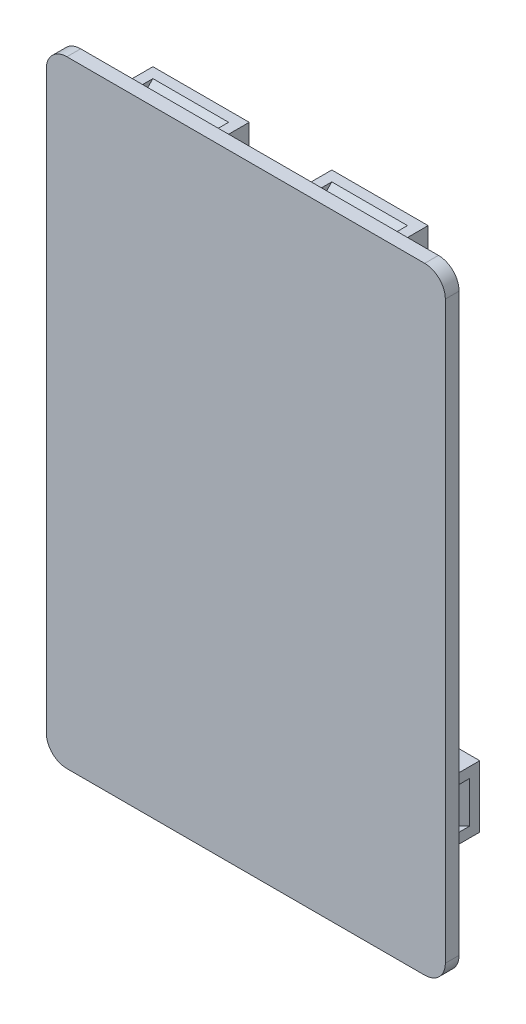
from build123d import *

# Parameters (mm, degrees)
EXTRUDE_1_DEPTH     = 2
SKETCH_4_W          = 11
SKETCH_4_H          = 1.5
EXTRUDE_3_DEPTH     = 4.5
CUT_EXTRUDE_3_DEPTH = 60
SKETCH_6_W          = 1.5
SKETCH_6_H          = 1.5
EXTRUDE_4_DEPTH     = 1.5
SKETCH_8_W          = 1.5
SKETCH_8_H          = 6
EXTRUDE_5_DEPTH     = 4.5
CUT_EXTRUDE_4_DEPTH = 20
SKETCH_12_W         = 1.5
SKETCH_12_H         = 1.5
EXTRUDE_7_DEPTH     = 1.5
SKETCH_13_W         = 1.5
SKETCH_13_H         = 1.5
EXTRUDE_8_DEPTH     = 1.5


with BuildPart() as part:
    # 草图2 → 凸台-拉伸1 (new body)
    with BuildSketch(Plane.XY):
        with BuildLine():
            Line((0, 86.6), (0, 3))
            ThreePointArc((0, 3), (0.878679656, 0.878679656), (3, 0))
            Line((3, 0), (55, 0))
            ThreePointArc((55, 0), (57.121320344, 0.878679656), (58, 3))
            Line((58, 3), (58, 86.6))
            ThreePointArc((58, 86.6), (57.121320344, 88.721320344), (55, 89.6))
            Line((55, 89.6), (3, 89.6))
            ThreePointArc((3, 89.6), (0.878679656, 88.721320344), (0, 86.6))
        make_face()
    extrude(amount=EXTRUDE_1_DEPTH)

    # 草图4 → 凸台-拉伸3 (add)
    with BuildSketch(Plane(origin=(0, 0, 0), x_dir=(-1, 0, 0), z_dir=(0, 0, -1))):
        Polygon((-35, 85.1), (-35, 88.1), (-36.5, 88.1), (-36.5, 86.6), (-47.5, 86.6), (-47.5, 88.1), (-49, 88.1), (-49, 85.1), align=None)
        Polygon((-21.5, 88.1), (-10.5, 88.1), (-9, 88.1), (-9, 85.1), (-23, 85.1), (-23, 88.1), align=None)
        with Locations((-42, 87.35)):
            Rectangle(SKETCH_4_W, SKETCH_4_H)
    extrude(amount=EXTRUDE_3_DEPTH)

    # 草图5 → 切除-拉伸3 (cut)
    with BuildSketch(Plane(origin=(49, 0, 0), x_dir=(0, 0, -1), z_dir=(1, 0, 0))):
        Polygon((1.5, 88.1), (1.5, 86.6), (3, 88.1), align=None)
        Polygon((0, 88.1), (1.5, 86.6), (1.5, 88.1), align=None)
    extrude(amount=-CUT_EXTRUDE_3_DEPTH, mode=Mode.SUBTRACT)

    # 草图6 → 凸台-拉伸4 (add)
    with BuildSketch(Plane(origin=(0, 88.1, 0), x_dir=(1, 0, 0), z_dir=(0, 1, 0))):
        Polygon((9, 0), (10.5, 0), (10.5, 4.5), (9, 4.5), (9, 3), (9, 1.5), align=None)
        Polygon((21.5, 0), (23, 0), (23, 1.5), (23, 3), (23, 4.5), (21.5, 4.5), align=None)
        with Locations((35.75, 3.75)):
            Rectangle(SKETCH_6_W, SKETCH_6_H)
        Polygon((36.5, 3), (35, 3), (35, 1.5), (35, 0), (36.5, 0), align=None)
        Polygon((49, 3), (47.5, 3), (47.5, 0), (49, 0), (49, 1.5), align=None)
        with Locations((48.25, 3.75)):
            Rectangle(SKETCH_6_W, SKETCH_6_H)
    extrude(amount=-EXTRUDE_4_DEPTH)

    # 草图8 → 凸台-拉伸5 (add)
    with BuildSketch(Plane(origin=(0, 0, 0), x_dir=(-1, 0, 0), z_dir=(0, 0, -1))):
        Polygon((-53.5, 24.5), (-56.5, 24.5), (-56.5, 23), (-55, 23), (-55, 17), (-56.5, 17), (-56.5, 15.5), (-53.5, 15.5), align=None)
        with Locations((-55.75, 20)):
            Rectangle(SKETCH_8_W, SKETCH_8_H)
        Polygon((-4.5, 15.5), (-4.5, 24.5), (-1.5, 24.5), (-1.5, 23), (-1.5, 17), (-1.5, 15.5), align=None)
    extrude(amount=EXTRUDE_5_DEPTH)

    # 草图9 → 切除-拉伸4 (cut)
    with BuildSketch(Plane.XZ.offset(-15.5)):
        Polygon((1.5, -3), (3, -1.5), (1.5, 0), align=None)
        Polygon((56.5, -3), (56.5, 0), (55, -1.5), align=None)
    extrude(amount=-CUT_EXTRUDE_4_DEPTH, mode=Mode.SUBTRACT)

    # 草图12 → 凸台-拉伸7 (add)
    with BuildSketch(Plane.ZY.offset(-1.5)):
        Polygon((0, 23), (0, 24.5), (-1.5, 24.5), (-3, 24.5), (-3, 23), align=None)
        Polygon((0, 15.5), (0, 17), (-3, 17), (-3, 15.5), (-1.5, 15.5), align=None)
        with Locations((-3.75, 23.75)):
            Rectangle(SKETCH_12_W, SKETCH_12_H)
        with Locations((-3.75, 16.25)):
            Rectangle(SKETCH_12_W, SKETCH_12_H)
    extrude(amount=-EXTRUDE_7_DEPTH)

    # 草图13 → 凸台-拉伸8 (add)
    with BuildSketch(Plane(origin=(56.5, 0, 0), x_dir=(0, 0, -1), z_dir=(1, 0, 0))):
        with Locations((3.75, 16.25)):
            Rectangle(SKETCH_13_W, SKETCH_13_H)
        Polygon((3, 17), (0, 17), (0, 15.5), (1.5, 15.5), (3, 15.5), align=None)
        with Locations((3.75, 23.75)):
            Rectangle(SKETCH_13_W, SKETCH_13_H)
        Polygon((1.5, 24.5), (0, 24.5), (0, 23), (3, 23), (3, 24.5), align=None)
    extrude(amount=-EXTRUDE_8_DEPTH)


solid = part.part
